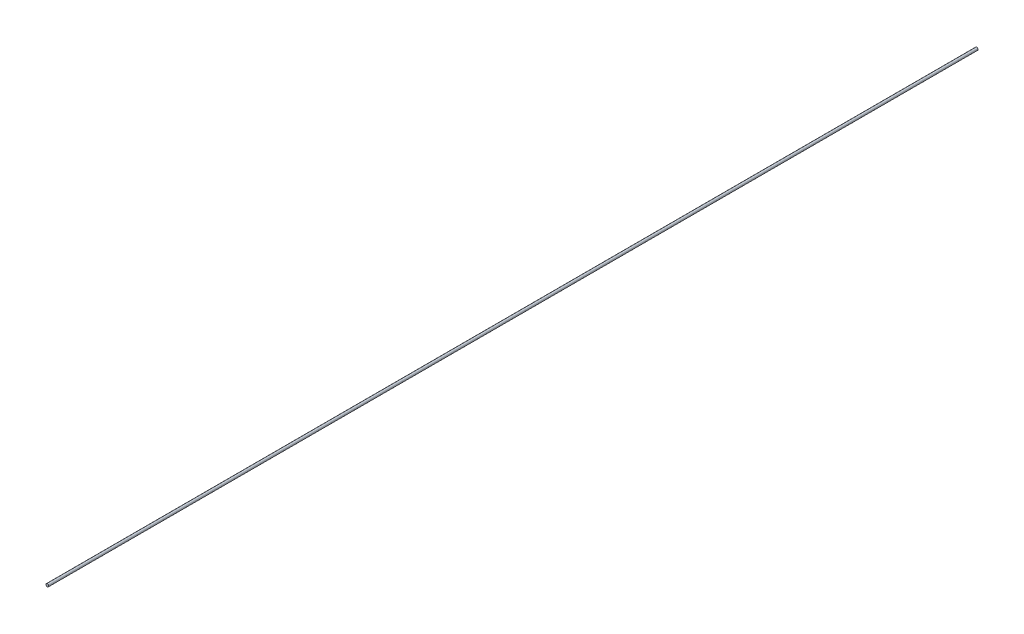
from build123d import *

# Parameters (mm, degrees)
CURVESKETCH_R   = 0.017
CURVEBOSS_DEPTH = 11.731


with BuildPart() as part:
    # CurveSketch → CurveBoss (new body)
    with BuildSketch(Plane.XY):
        with Locations((-3.719, 5.173)):
            Circle(CURVESKETCH_R)
    extrude(amount=CURVEBOSS_DEPTH)


solid = part.part
